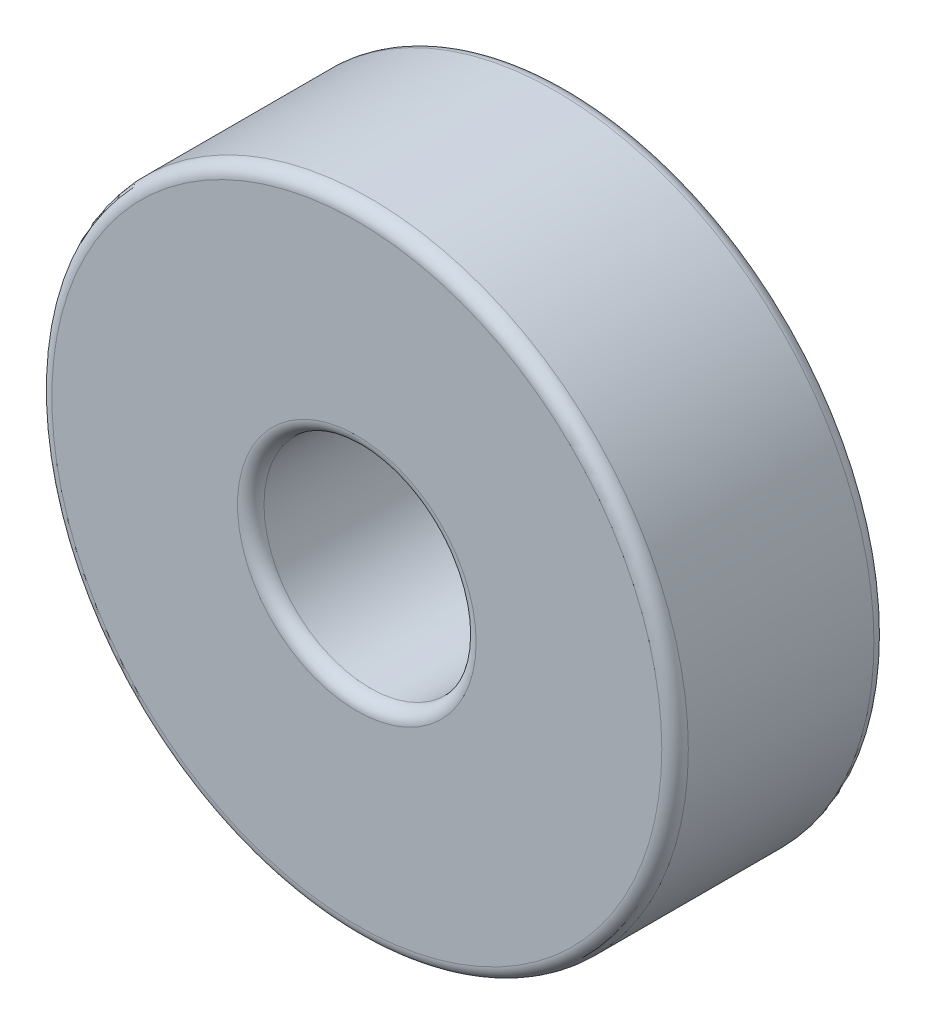
from build123d import *

# Parameters (mm, degrees)
CROQUIS1_R              = 12
CROQUIS1_R_2            = 4
SALIENTE_EXTRUIR1_DEPTH = 8
REDONDEO1_R             = 0.5


with BuildPart() as part:
    # Croquis1 → Saliente-Extruir1 (new body)
    with BuildSketch(Plane.XY):
        Circle(CROQUIS1_R)
        Circle(CROQUIS1_R_2, mode=Mode.SUBTRACT)
    extrude(amount=SALIENTE_EXTRUIR1_DEPTH)

    # Redondeo1
    redondeo1_edges = [part.edges().sort_by_distance(p)[0] for p in [
        (-12, 0, 0),
        (-12, 0, 8),
        (-4, 0, 0),
        (-4, 0, 8),
    ]]
    fillet(redondeo1_edges, radius=REDONDEO1_R)


solid = part.part
